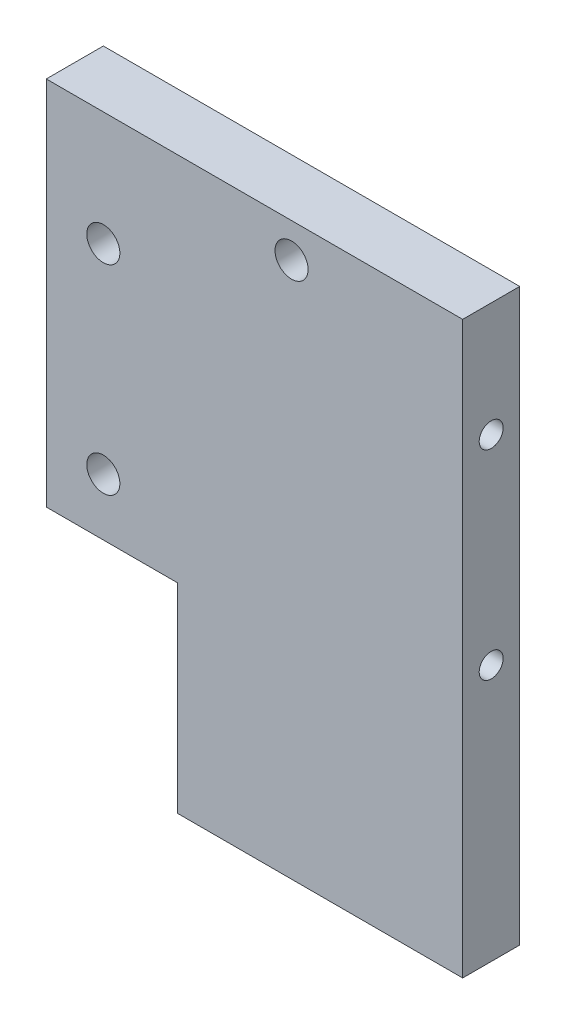
from build123d import *

# Parameters (mm, degrees)
SKETCH_1_W                   = 73
SKETCH_1_H                   = 100
EXTRUDE_1_DEPTH              = 10
HOLE_WIZARD_M5_1_D           = 5.8
HOLE_WIZARD_M5_1_CBORE_D     = 10
HOLE_WIZARD_M5_1_CBORE_DEPTH = 5
HOLE_WIZARD_M5_1_2_D         = 4.2
HOLE_WIZARD_M5_1_2_DEPTH     = 12.4
HOLE_WIZARD_M5_1_2_TIP       = 1.2618073
SKETCH_6_W                   = 23
SKETCH_6_H                   = 35
CUT_EXTRUDE_1_DEPTH          = 125.213525834


with BuildPart() as part:
    # 草图1 → 凸台-拉伸1 (new body)
    with BuildSketch(Plane.XY):
        with Locations((36.5, 50)):
            Rectangle(SKETCH_1_W, SKETCH_1_H)
    extrude(amount=EXTRUDE_1_DEPTH)

    # Hole Wizard M5 _1 (through all)
    with Locations(Plane(origin=(0, 0, 0), x_dir=(-1, 0, 0), z_dir=(0, 0, -1))):
        with Locations((-10, 80), (-43, 94), (-10, 45)):
            CounterBoreHole(HOLE_WIZARD_M5_1_D / 2, HOLE_WIZARD_M5_1_CBORE_D / 2, HOLE_WIZARD_M5_1_CBORE_DEPTH)

    # Hole Wizard M5 _1 2
    with Locations(Plane(origin=(73, 0, 0), x_dir=(0, 0, -1), z_dir=(1, 0, 0))):
        with Locations((-5, 80), (-5, 45)):
            Hole(HOLE_WIZARD_M5_1_2_D / 2, depth=HOLE_WIZARD_M5_1_2_DEPTH)
            with Locations((0, 0, -(HOLE_WIZARD_M5_1_2_DEPTH + HOLE_WIZARD_M5_1_2_TIP / 2))):  # 118° drill point
                Cone(0, HOLE_WIZARD_M5_1_2_D / 2, HOLE_WIZARD_M5_1_2_TIP, mode=Mode.SUBTRACT)

    # 草图6 → 切除-拉伸1 (cut, through all)
    with BuildSketch(Plane(origin=(0, 0, 0), x_dir=(-1, 0, 0), z_dir=(0, 0, -1))):
        with Locations((-11.5, 17.5)):
            Rectangle(SKETCH_6_W, SKETCH_6_H)
    extrude(amount=-CUT_EXTRUDE_1_DEPTH, mode=Mode.SUBTRACT)


solid = part.part
